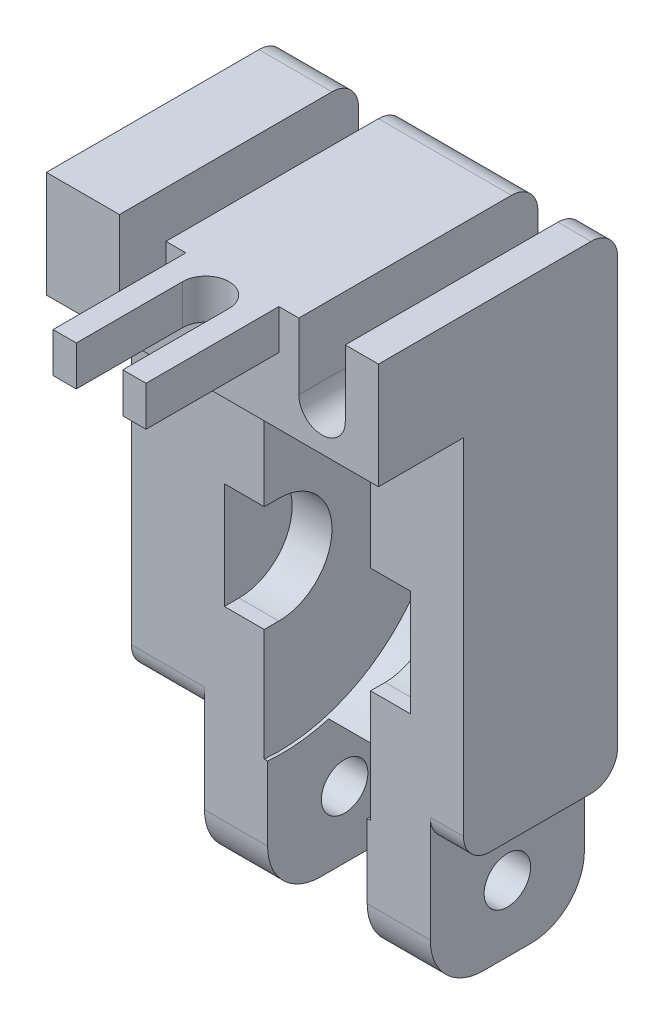
from build123d import *

# Parameters (mm, degrees)
SKETCH1_W               = 25
SKETCH1_H               = 46
BOSS_EXTRUDE1_DEPTH     = 18
SKETCH2_W               = 7
SKETCH2_H               = 3
BOSS_EXTRUDE2_DEPTH     = 10
CUT_EXTRUDE1_DEPTH      = 10
CUT_EXTRUDE2_DEPTH      = 4
CUT_EXTRUDE2_DEPTH_BACK = 4
SKETCH5_R               = 12.5
CUT_EXTRUDE3_DEPTH      = 7
CUT_EXTRUDE3_DEPTH_BACK = 7
CUT_EXTRUDE4_REACH      = 61.372
SKETCH8_R               = 1.75
SKETCH9_W               = 6.4
SKETCH9_H               = 38
CUT_EXTRUDE5_DEPTH      = 36
SKETCH10_W              = 7.5
SKETCH10_H              = 10
SKETCH10_W_2            = 2.5
SKETCH10_W_3            = 5.5
CUT_EXTRUDE6_DEPTH      = 32
FILLET1_R               = 4
FILLET2_R               = 2
CUT_EXTRUDE7_DEPTH      = 32


with BuildPart() as part:
    # Sketch1 → Boss-Extrude1 (new body)
    with BuildSketch(Plane.XY):
        with Locations((-12.5, 23)):
            Rectangle(SKETCH1_W, SKETCH1_H)
    extrude(amount=BOSS_EXTRUDE1_DEPTH)

    # Sketch2 → Boss-Extrude2 (add)
    with BuildSketch(Plane.XY.offset(18)):
        with Locations((-11, 44.5)):
            Rectangle(SKETCH2_W, SKETCH2_H)
    extrude(amount=BOSS_EXTRUDE2_DEPTH)

    # Sketch3 → Cut-Extrude1 (cut)
    with BuildSketch(Plane(origin=(0, 46, 0), x_dir=(1, 0, 0), z_dir=(0, 1, 0))):
        with BuildLine():
            Line((-12.75, -28), (-12.75, -20))
            ThreePointArc((-12.75, -20), (-11, -18.25), (-9.25, -20))
            Line((-9.25, -20), (-9.25, -28))
            ThreePointArc((-9.25, -28), (-11, -29.75), (-12.75, -28))
        make_face()
    extrude(amount=-CUT_EXTRUDE1_DEPTH, mode=Mode.SUBTRACT)

    # Sketch5 → Cut-Extrude2 (cut, two sides: drawn at the far end of the back side and taken through both)
    with BuildSketch(Plane.ZY.offset(11).offset(-CUT_EXTRUDE2_DEPTH_BACK)):
        with Locations((10.5, 22)):
            Circle(SKETCH5_R)
    extrude(amount=CUT_EXTRUDE2_DEPTH + CUT_EXTRUDE2_DEPTH_BACK, mode=Mode.SUBTRACT)

    # Sketch7 → Cut-Extrude3 (cut, two sides: drawn at the far end of the back side and taken through both)
    with BuildSketch(Plane.ZY.offset(11).offset(-CUT_EXTRUDE3_DEPTH_BACK)):
        with BuildLine():
            Line((10.5, 26), (19.804509891, 26))
            ThreePointArc((19.804509891, 26), (23.804509891, 22), (19.804509891, 18))
            Line((19.804509891, 18), (10.5, 18))
            ThreePointArc((10.5, 18), (6.5, 22), (10.5, 26))
        make_face()
    extrude(amount=CUT_EXTRUDE3_DEPTH + CUT_EXTRUDE3_DEPTH_BACK, mode=Mode.SUBTRACT)

    # Sketch8 → Cut-Extrude4 (cut, up to next)
    with BuildSketch(Plane.ZY.offset(25), mode=Mode.PRIVATE) as cut_extrude4_sk1:
        with Locations((5.8, 5)):
            Circle(SKETCH8_R)
    cut_extrude4_tool1 = extrude(cut_extrude4_sk1.sketch, amount=-CUT_EXTRUDE4_REACH, mode=Mode.PRIVATE) & part.part
    add(cut_extrude4_tool1.solids().sort_by_distance((-25, 5, 5.8))[0], mode=Mode.SUBTRACT)

    # Sketch9 → Cut-Extrude5 (cut)
    with BuildSketch(Plane.ZY.offset(25)):
        with Locations((14.8, 19)):
            Rectangle(SKETCH9_W, SKETCH9_H)
    extrude(amount=-CUT_EXTRUDE5_DEPTH, mode=Mode.SUBTRACT)

    # Sketch10 → Cut-Extrude6 (cut)
    with BuildSketch(Plane.XY.offset(11.6)):
        with Locations((-11, 5)):
            Rectangle(SKETCH10_W, SKETCH10_H)
        with Locations((-1.25, 5)):
            Rectangle(SKETCH10_W_2, SKETCH10_H)
        with Locations((-22.25, 5)):
            Rectangle(SKETCH10_W_3, SKETCH10_H)
    extrude(amount=-CUT_EXTRUDE6_DEPTH, mode=Mode.SUBTRACT)

    # Fillet1
    fillet1_edges = [part.edges().sort_by_distance(p)[0] for p in [
        (-17.125, 0, 11.6),
        (-4.875, 0, 0),
        (-4.875, 0, 11.6),
        (-17.125, 0, 0),
    ]]
    fillet(fillet1_edges, radius=FILLET1_R)

    # Fillet2
    fillet2_edges = [part.edges().sort_by_distance(p)[0] for p in [
        (-11, 10, 0),
        (-1.25, 10, 0),
        (-1.25, 10, 11.6),
        (-22.25, 10, 0),
        (-22.25, 10, 11.6),
        (-12.5, 46, 0),
    ]]
    fillet(fillet2_edges, radius=FILLET2_R)

    # Sketch11 → Cut-Extrude7 (cut)
    with BuildSketch(Plane.XY.offset(18)):
        with BuildLine():
            Line((-19.5, 41), (-19.5, 46.514894744))
            Line((-19.5, 46.514894744), (-16, 46.514894744))
            Line((-16, 46.514894744), (-16, 41))
            ThreePointArc((-16, 41), (-17.75, 39.25), (-19.5, 41))
        make_face()
        with BuildLine():
            Line((-6, 41), (-6, 46.514894744))
            Line((-6, 46.514894744), (-2.5, 46.514894744))
            Line((-2.5, 46.514894744), (-2.5, 41))
            ThreePointArc((-2.5, 41), (-4.25, 39.25), (-6, 41))
        make_face()
    extrude(amount=-CUT_EXTRUDE7_DEPTH, mode=Mode.SUBTRACT)


solid = part.part
